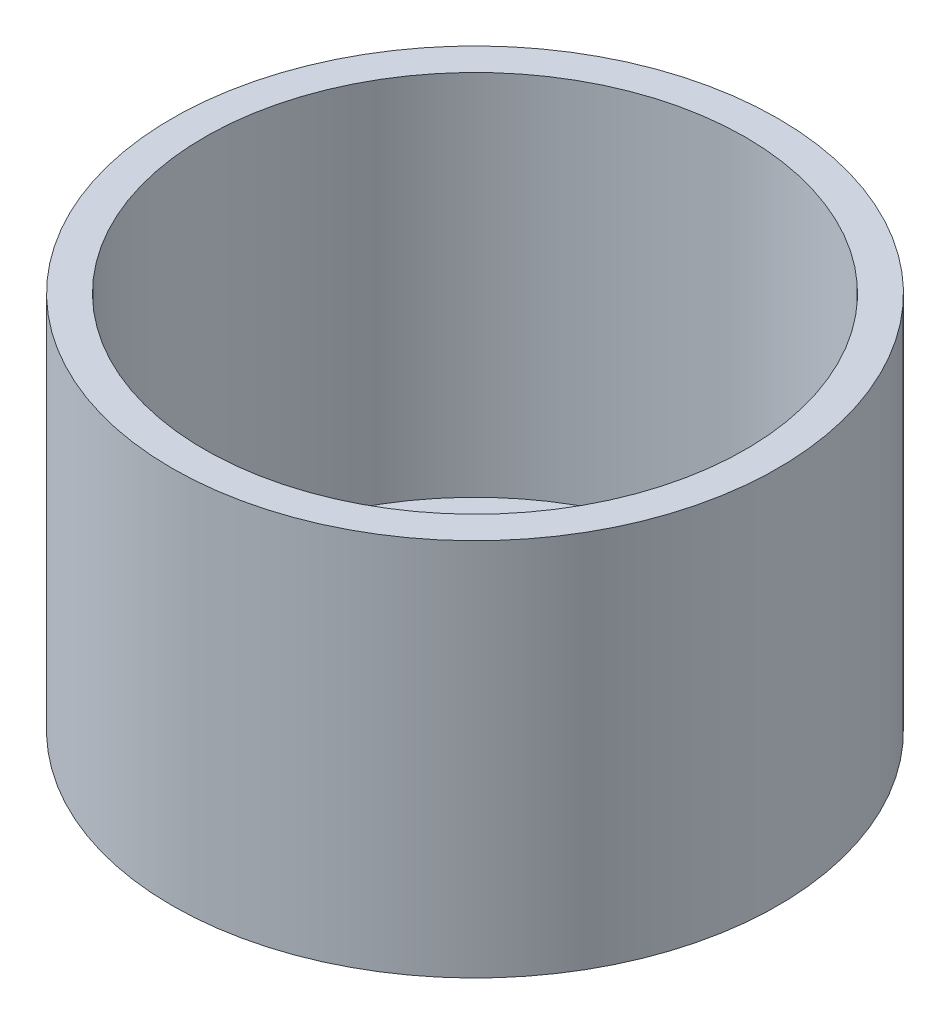
from build123d import *

# Parameters (mm, degrees)
SKETCH1_W           = 250
SKETCH1_H           = 250
BOSS_EXTRUDE1_DEPTH = 5
SKETCH8_R           = 7.5
BOSS_EXTRUDE3_DEPTH = 5
FILLET6_R           = 2
FILLET7_R           = 0.5
SKETCH11_R          = 2.5
CUT_EXTRUDE4_DEPTH  = 10
SKETCH12_OUTSIDE_W  = 322.738
SKETCH12_OUTSIDE_H  = 322.738
SKETCH12_OUTSIDE_R  = 125
CUT_EXTRUDE5_DEPTH  = 10
SKETCH13_R          = 140
SKETCH13_R_2        = 125
BOSS_EXTRUDE4_DEPTH = 175


with BuildPart() as part:
    # Sketch1 → Boss-Extrude1 (new body)
    with BuildSketch(Plane(origin=(0, 0, 0), x_dir=(1, 0, 0), z_dir=(0, 1, 0))):
        Rectangle(SKETCH1_W, SKETCH1_H)
    extrude(amount=BOSS_EXTRUDE1_DEPTH)

    # Sketch8 → Boss-Extrude3 (add)
    with BuildSketch(Plane(origin=(0, 5, 0), x_dir=(1, 0, 0), z_dir=(0, 1, 0))):
        with Locations(Location((99.778960279, -1.147118049, 0), (0, 0, 90))):
            Circle(SKETCH8_R)
        with Locations(Location((0, -95, 0), (0, 0, 90))):
            Circle(SKETCH8_R)
    extrude(amount=BOSS_EXTRUDE3_DEPTH)

    # Sketch9 → Cut-Revolve3 (revolve, cut)
    with BuildSketch(Plane(origin=(0, 0, 0), x_dir=(0, 0, -1), z_dir=(1, 0, 0))):
        with BuildLine():
            Line((-95, 15), (-95, 5))
            ThreePointArc((-95, 5), (-100, 10), (-95, 15))
        make_face()
    revolve(axis=Axis((0, 10, 95), (0, -1, 0)), mode=Mode.SUBTRACT)

    # Sketch10 → Cut-Revolve4 (revolve, cut)
    with BuildSketch(Plane.XY.offset(1.05)):
        with BuildLine():
            Line((99.778960279, 15), (99.778960279, 5))
            ThreePointArc((99.778960279, 5), (94.778960279, 10), (99.778960279, 15))
        make_face()
    revolve(axis=Axis((99.778960279, 15, 1.05), (0, -1, 0)), mode=Mode.SUBTRACT)

    # Fillet6
    fillet6_edges = [part.edges().sort_by_distance(p)[0] for p in [
        (99.778960279, 5, 8.647118049),
        (0, 5, 102.5),
    ]]
    fillet(fillet6_edges, radius=FILLET6_R)

    # Fillet7
    fillet7_edges = [part.edges().sort_by_distance(p)[0] for p in [
        (99.778960279, 10, 8.647118049),
        (0, 10, 102.5),
    ]]
    fillet(fillet7_edges, radius=FILLET7_R)

    # Sketch11 → Cut-Extrude4 (cut)
    with BuildSketch(Plane(origin=(0, 5, 0), x_dir=(1, 0, 0), z_dir=(0, 1, 0))):
        with Locations(Location((-19.240698593, 30.202545091, 0), (0, 0, 270))):
            Circle(SKETCH11_R)
        with Locations(Location((-37.517445985, 68.490408766, 0), (0, 0, 270))):
            Circle(SKETCH11_R)
        with Locations(Location((-47.523004126, 40.208103233, 0), (0, 0, 270))):
            Circle(SKETCH11_R)
        with Locations(Location((-9.235140451, 58.484850625, 0), (0, 0, 270))):
            Circle(SKETCH11_R)
    extrude(amount=-CUT_EXTRUDE4_DEPTH, mode=Mode.SUBTRACT)

    # Sketch12 outside → Cut-Extrude5 (cut)
    with BuildSketch(Plane(origin=(0, 0, 0), x_dir=(-1, 0, 0), z_dir=(0, -1, 0))):
        Rectangle(SKETCH12_OUTSIDE_W, SKETCH12_OUTSIDE_H)
        with Locations(Location((0, 0, 0), (0, 0, 90))):
            Circle(SKETCH12_OUTSIDE_R, mode=Mode.SUBTRACT)
    extrude(amount=-CUT_EXTRUDE5_DEPTH, mode=Mode.SUBTRACT)

    # Sketch13 → Boss-Extrude4 (add)
    with BuildSketch(Plane.XZ):
        with Locations(Location((0, 0, 0), (0, 0, 270))):
            Circle(SKETCH13_R)
        with Locations(Location((0, 0, 0), (0, 0, 270))):
            Circle(SKETCH13_R_2, mode=Mode.SUBTRACT)
    extrude(amount=-BOSS_EXTRUDE4_DEPTH)


solid = part.part
